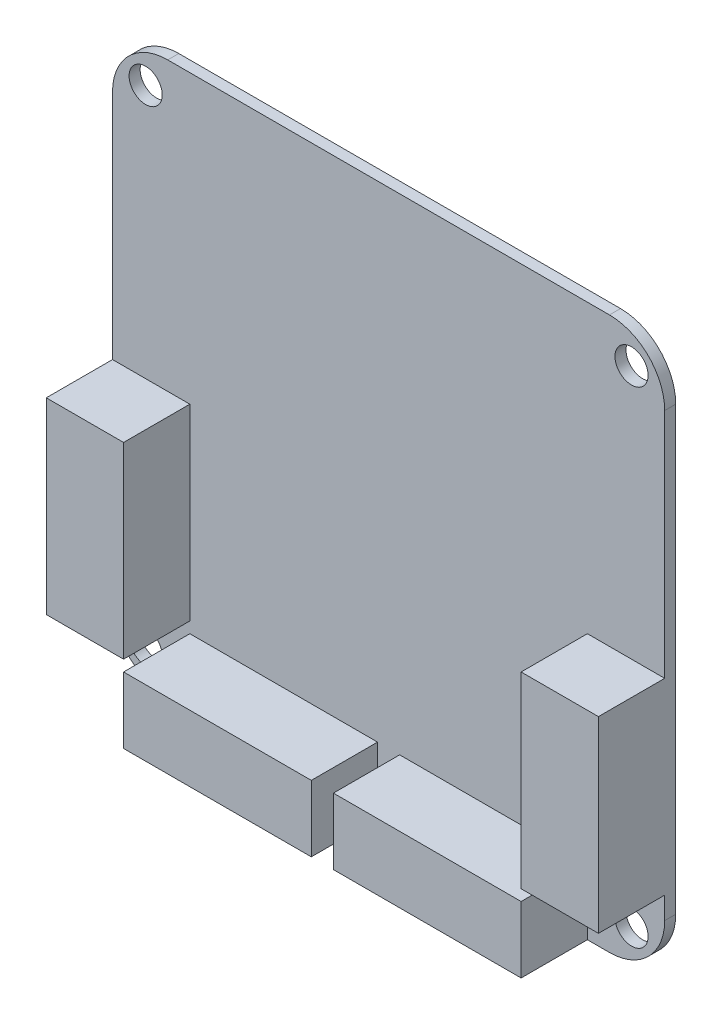
from build123d import *

# Parameters (mm, degrees)
SKETCH_1_W          = 50
SKETCH_1_H          = 50
EXTRUDE_1_DEPTH     = 1
FILLET_1_R          = 5
SKETCH_2_W          = 17
SKETCH_2_H          = 6
SKETCH_2_W_2        = 7
SKETCH_2_H_2        = 17
EXTRUDE_2_DEPTH     = 6
SKETCH_3_R          = 1.5
CUT_EXTRUDE_1_DEPTH = 10


with BuildPart() as part:
    # 草图1 → 凸台-拉伸1 (new body)
    with BuildSketch(Plane.XY):
        Rectangle(SKETCH_1_W, SKETCH_1_H)
    extrude(amount=EXTRUDE_1_DEPTH)

    # 圆角1
    fillet_1_edges = [part.edges().sort_by_distance(p)[0] for p in [
        (-25, 25, 0.5),
        (25, 25, 0.5),
        (25, -25, 0.5),
        (-25, -25, 0.5),
    ]]
    fillet(fillet_1_edges, radius=FILLET_1_R)

    # 草图2 → 凸台-拉伸2 (add)
    with BuildSketch(Plane.XY.offset(1)):
        with Locations((-9.5, -22)):
            Rectangle(SKETCH_2_W, SKETCH_2_H)
        with Locations((-21.5, -9.5)):
            Rectangle(SKETCH_2_W_2, SKETCH_2_H_2)
        with Locations((9.5, -22)):
            Rectangle(SKETCH_2_W, SKETCH_2_H)
        with Locations((21.5, -9.5)):
            Rectangle(SKETCH_2_W_2, SKETCH_2_H_2)
    extrude(amount=EXTRUDE_2_DEPTH)

    # 草图3 → 切除-拉伸1 (cut)
    with BuildSketch(Plane.XY.offset(1)):
        with Locations((-22, 22)):
            Circle(SKETCH_3_R)
        with Locations((22, 22)):
            Circle(SKETCH_3_R)
        with Locations((-22, -22)):
            Circle(SKETCH_3_R)
        with Locations((22, -22)):
            Circle(SKETCH_3_R)
    extrude(amount=-CUT_EXTRUDE_1_DEPTH, mode=Mode.SUBTRACT)


solid = part.part
